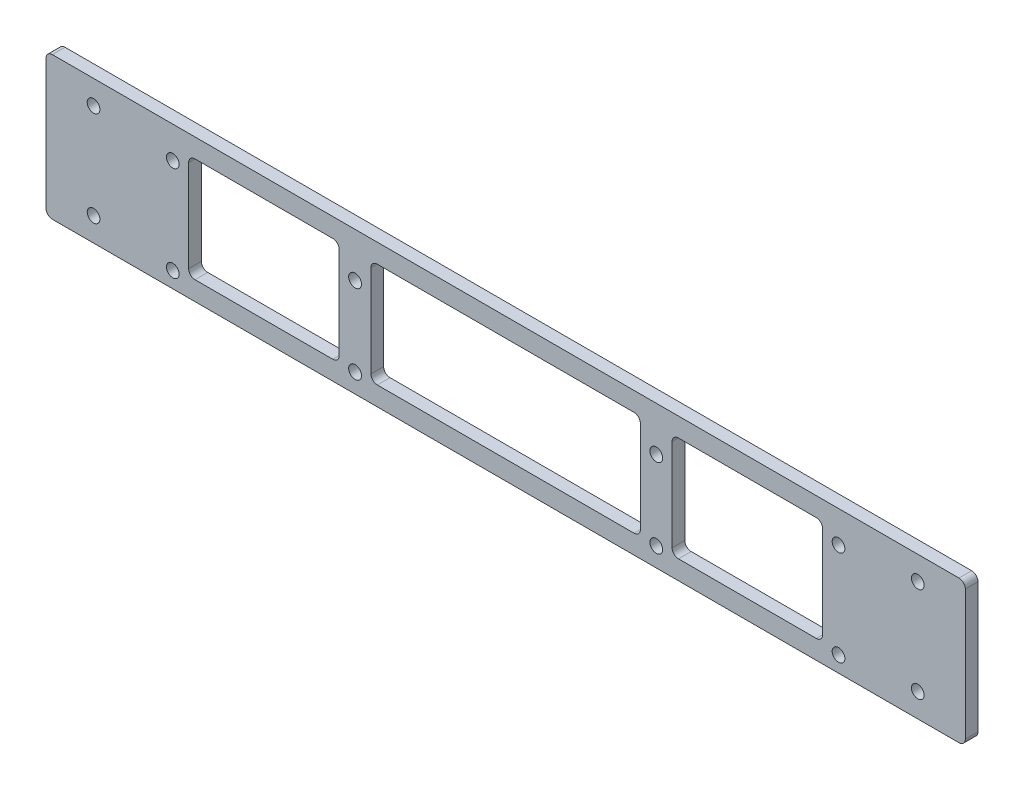
from build123d import *

# Parameters (mm, degrees)
SKETCH_1_W          = 290
SKETCH_1_H          = 45
EXTRUDE_1_DEPTH     = 2
SKETCH_3_R          = 2.025
CUT_EXTRUDE_1_DEPTH = 10
SKETCH_4_R          = 2
CUT_EXTRUDE_2_DEPTH = 10
SKETCH_5_R          = 2
CUT_EXTRUDE_3_DEPTH = 35
SKETCH_6_W          = 47.500000831
SKETCH_6_H          = 33
CUT_EXTRUDE_4_DEPTH = 129.5
SKETCH_7_W          = 84.999998338
SKETCH_7_H          = 33
CUT_EXTRUDE_5_DEPTH = 129.5
FILLET_1_R          = 2
FILLET_2_R          = 2


with BuildPart() as part:
    # 草图1 → 凸台-拉伸1 (new, symmetric)
    with BuildSketch(Plane.XY):
        Rectangle(SKETCH_1_W, SKETCH_1_H)
    extrude(amount=EXTRUDE_1_DEPTH, both=True)

    # 草图3 → 切除-拉伸1 (cut)
    with BuildSketch(Plane(origin=(0, 0, -2), x_dir=(-1, 0, 0), z_dir=(0, 0, -1))):
        with Locations((-47.499999169, 8.524320115)):
            Circle(SKETCH_3_R)
        with Locations((-47.499999169, -16.475679885)):
            Circle(SKETCH_3_R)
        with Locations((47.500000831, 8.524320115)):
            Circle(SKETCH_3_R)
        with Locations((47.500000831, -16.475679885)):
            Circle(SKETCH_3_R)
    extrude(amount=-CUT_EXTRUDE_1_DEPTH, mode=Mode.SUBTRACT)

    # 草图4 → 切除-拉伸2 (cut)
    with BuildSketch(Plane(origin=(0, 0, -2), x_dir=(-1, 0, 0), z_dir=(0, 0, -1))):
        with Locations((-130, 15)):
            Circle(SKETCH_4_R)
        with Locations((-130, -15)):
            Circle(SKETCH_4_R)
    cut_extrude_2 = extrude(amount=-CUT_EXTRUDE_2_DEPTH, mode=Mode.SUBTRACT)

    # 镜向1: 切除-拉伸2 across plane
    add(cut_extrude_2.mirror(Plane(origin=(0, 0, 0), x_dir=(0, 0, 1), z_dir=(1, 0, 0))), mode=Mode.SUBTRACT)

    # 草图5 → 切除-拉伸3 (cut, symmetric)
    with BuildSketch(Plane(origin=(0, 0, -2), x_dir=(-1, 0, 0), z_dir=(0, 0, -1))):
        with Locations((-105, -17.5)):
            Circle(SKETCH_5_R)
        with Locations((-105, 12.5)):
            Circle(SKETCH_5_R)
    cut_extrude_3 = extrude(amount=CUT_EXTRUDE_3_DEPTH, both=True, mode=Mode.SUBTRACT)

    # 镜向2: 切除-拉伸3 across plane
    add(cut_extrude_3.mirror(Plane(origin=(0, 0, 0), x_dir=(0, 0, 1), z_dir=(1, 0, 0))), mode=Mode.SUBTRACT)

    # 草图6 → 切除-拉伸4 (cut, symmetric)
    with BuildSketch(Plane(origin=(0, 0, -2), x_dir=(-1, 0, 0), z_dir=(0, 0, -1))):
        with Locations((-76.249999585, 0)):
            Rectangle(SKETCH_6_W, SKETCH_6_H)
    cut_extrude_4 = extrude(amount=CUT_EXTRUDE_4_DEPTH, both=True, mode=Mode.SUBTRACT)

    # 镜向3: 切除-拉伸4 across plane
    add(cut_extrude_4.mirror(Plane(origin=(0, 0, 0), x_dir=(0, 0, 1), z_dir=(1, 0, 0))), mode=Mode.SUBTRACT)

    # 草图7 → 切除-拉伸5 (cut, symmetric)
    with BuildSketch(Plane(origin=(0, 0, -2), x_dir=(-1, 0, 0), z_dir=(0, 0, -1))):
        Rectangle(SKETCH_7_W, SKETCH_7_H)
    extrude(amount=CUT_EXTRUDE_5_DEPTH, both=True, mode=Mode.SUBTRACT)

    # 圆角1
    fillet_1_edges = [part.edges().sort_by_distance(p)[0] for p in [
        (-52.499999169, -16.5, 0),
        (-52.499999169, 16.5, 0),
        (-100, 16.5, 0),
        (-100, -16.5, 0),
        (-42.499999169, 16.5, 0),
        (-42.499999169, -16.5, 0),
        (42.499999169, -16.5, 0),
        (42.499999169, 16.5, 0),
        (52.499999169, 16.5, 0),
        (52.499999169, -16.5, 0),
        (100, -16.5, 0),
        (100, 16.5, 0),
    ]]
    fillet(fillet_1_edges, radius=FILLET_1_R)

    # 圆角2
    fillet_2_edges = [part.edges().sort_by_distance(p)[0] for p in [
        (145, -22.5, 0),
        (-145, -22.5, 0),
        (-145, 22.5, 0),
        (145, 22.5, 0),
    ]]
    fillet(fillet_2_edges, radius=FILLET_2_R)


solid = part.part
